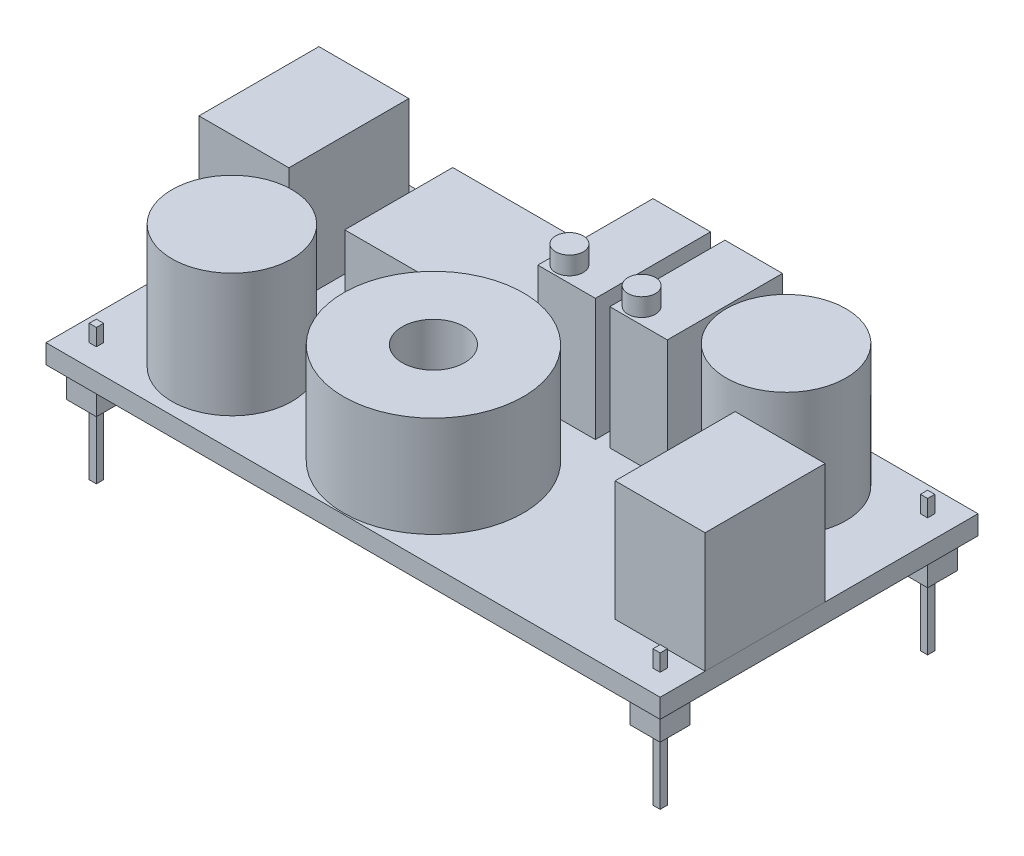
from build123d import *

# Parameters (mm, degrees)
ESQUISSE1_W               = 51.2
ESQUISSE1_H               = 26.5
BOSS_EXTRU_1_DEPTH        = 1.6
ESQUISSE2_W               = 7.5
ESQUISSE2_H               = 10
BOSS_EXTRU_2_DEPTH        = 10
BOSS_EXTRU_2_2_DEPTH      = 10
ESQUISSE3_R               = 5
BOSS_EXTRU_3_DEPTH        = 10.3
BOSS_EXTRU_3_2_DEPTH      = 10.3
ESQUISSE4_W               = 4.8
ESQUISSE4_H               = 9.6
BOSS_EXTRU_4_DEPTH        = 10.2
BOSS_EXTRU_4_2_DEPTH      = 10.2
ESQUISSE5_R               = 1.15
BOSS_EXTRU_5_DEPTH        = 1.5
BOSS_EXTRU_5_2_DEPTH      = 1.5
ESQUISSE6_R               = 7.5
ESQUISSE6_R_2             = 2.6
BOSS_EXTRU_6_DEPTH        = 8.4
ESQUISSE7_W               = 14
ESQUISSE7_H               = 9
BOSS_EXTRU_7_DEPTH        = 4.7
BOSS_EXTRU_8_DEPTH        = 8.3
BOSS_EXTRU_8_DEPTH_BACK   = 3
ESQUISSE8_W               = 0.6
ESQUISSE8_H               = 0.6
BOSS_EXTRU_8_2_DEPTH      = 8.3
BOSS_EXTRU_8_2_DEPTH_BACK = 3
BOSS_EXTRU_8_3_DEPTH      = 8.3
BOSS_EXTRU_8_3_DEPTH_BACK = 3
BOSS_EXTRU_8_4_DEPTH      = 8.3
BOSS_EXTRU_8_4_DEPTH_BACK = 3
ESQUISSE9_W               = 2.5
ESQUISSE9_H               = 2.5
BOSS_EXTRU_9_DEPTH        = 2.5
BOSS_EXTRU_9_2_DEPTH      = 2.5
BOSS_EXTRU_9_3_DEPTH      = 2.5
BOSS_EXTRU_9_4_DEPTH      = 2.5


with BuildPart() as part:
    # Esquisse1 → Boss.-Extru.1 (new body)
    with BuildSketch(Plane(origin=(0, 0, 0), x_dir=(1, 0, 0), z_dir=(0, 1, 0))):
        Rectangle(ESQUISSE1_W, ESQUISSE1_H)
    extrude(amount=BOSS_EXTRU_1_DEPTH)


with BuildPart() as body_2:
    # Esquisse2 → Boss.-Extru.2 (new body)
    with BuildSketch(Plane(origin=(0, 1.6, 0), x_dir=(1, 0, 0), z_dir=(0, 1, 0))):
        with Locations((-21.85, 4.5)):
            Rectangle(ESQUISSE2_W, ESQUISSE2_H)
    extrude(amount=BOSS_EXTRU_2_DEPTH)


with BuildPart() as body_3:
    # Esquisse2 → Boss.-Extru.2 2 (new body)
    with BuildSketch(Plane(origin=(0, 1.6, 0), x_dir=(1, 0, 0), z_dir=(0, 1, 0))):
        with Locations((21.85, -4.5)):
            Rectangle(ESQUISSE2_W, ESQUISSE2_H)
    extrude(amount=BOSS_EXTRU_2_2_DEPTH)


with BuildPart() as body_4:
    # Esquisse3 → Boss.-Extru.3 (new body)
    with BuildSketch(Plane(origin=(0, 1.6, 0), x_dir=(1, 0, 0), z_dir=(0, 1, 0))):
        with Locations(Location((15.6, 7.25, 0), (0, 0, 90))):
            Circle(ESQUISSE3_R)
    extrude(amount=BOSS_EXTRU_3_DEPTH)


with BuildPart() as body_5:
    # Esquisse3 → Boss.-Extru.3 2 (new body)
    with BuildSketch(Plane(origin=(0, 1.6, 0), x_dir=(1, 0, 0), z_dir=(0, 1, 0))):
        with Locations(Location((-16.1, -7.25, 0), (0, 0, 90))):
            Circle(ESQUISSE3_R)
    extrude(amount=BOSS_EXTRU_3_2_DEPTH)


with BuildPart() as body_6:
    # Esquisse4 → Boss.-Extru.4 (new body)
    with BuildSketch(Plane(origin=(0, 1.6, 0), x_dir=(1, 0, 0), z_dir=(0, 1, 0))):
        with Locations((1.9, 7.45)):
            Rectangle(ESQUISSE4_W, ESQUISSE4_H)
    extrude(amount=BOSS_EXTRU_4_DEPTH)


with BuildPart() as body_7:
    # Esquisse4 → Boss.-Extru.4 2 (new body)
    with BuildSketch(Plane(origin=(0, 1.6, 0), x_dir=(1, 0, 0), z_dir=(0, 1, 0))):
        with Locations((7.9, 7.45)):
            Rectangle(ESQUISSE4_W, ESQUISSE4_H)
    extrude(amount=BOSS_EXTRU_4_2_DEPTH)


with BuildPart() as body_8:
    # Esquisse5 → Boss.-Extru.5 (new body)
    with BuildSketch(Plane(origin=(0, 11.8, 0), x_dir=(1, 0, 0), z_dir=(0, 1, 0))):
        with Locations(Location((0.784252414, 4.00485602, 0), (0, 0, 270))):
            Circle(ESQUISSE5_R)
    extrude(amount=BOSS_EXTRU_5_DEPTH)


with BuildPart() as body_9:
    # Esquisse5 → Boss.-Extru.5 2 (new body)
    with BuildSketch(Plane(origin=(0, 11.8, 0), x_dir=(1, 0, 0), z_dir=(0, 1, 0))):
        with Locations(Location((6.804540863, 4.00485602, 0), (0, 0, 270))):
            Circle(ESQUISSE5_R)
    extrude(amount=BOSS_EXTRU_5_2_DEPTH)


with BuildPart() as body_10:
    # Esquisse6 → Boss.-Extru.6 (new body)
    with BuildSketch(Plane(origin=(0, 1.6, 0), x_dir=(1, 0, 0), z_dir=(0, 1, 0))):
        with Locations(Location((-0.9, -5.65, 0), (0, 0, 270))):
            Circle(ESQUISSE6_R)
        with Locations(Location((-0.9, -5.65, 0), (0, 0, 270))):
            Circle(ESQUISSE6_R_2, mode=Mode.SUBTRACT)
    extrude(amount=BOSS_EXTRU_6_DEPTH)


with BuildPart() as body_11:
    # Esquisse7 → Boss.-Extru.7 (new body)
    with BuildSketch(Plane(origin=(0, 1.6, 0), x_dir=(1, 0, 0), z_dir=(0, 1, 0))):
        with Locations((-9.592278393, 7.15)):
            Rectangle(ESQUISSE7_W, ESQUISSE7_H)
    extrude(amount=BOSS_EXTRU_7_DEPTH)


with BuildPart() as body_12:
    # Esquisse8 → Boss.-Extru.8 (new, two sides: drawn at the far end of the back side and taken through both)
    with BuildSketch(Plane.XZ.offset(-BOSS_EXTRU_8_DEPTH_BACK)):
        with Locations((-23.5, 11.15)):
            Rectangle(ESQUISSE8_W, ESQUISSE8_H)
    extrude(amount=BOSS_EXTRU_8_DEPTH + BOSS_EXTRU_8_DEPTH_BACK)


with BuildPart() as body_13:
    # Esquisse8 → Boss.-Extru.8 2 (new, two sides: drawn at the far end of the back side and taken through both)
    with BuildSketch(Plane.XZ.offset(-BOSS_EXTRU_8_2_DEPTH_BACK)):
        with Locations((23.5, 11.15)):
            Rectangle(ESQUISSE8_W, ESQUISSE8_H)
    extrude(amount=BOSS_EXTRU_8_2_DEPTH + BOSS_EXTRU_8_2_DEPTH_BACK)


with BuildPart() as body_14:
    # Esquisse8 → Boss.-Extru.8 3 (new, two sides: drawn at the far end of the back side and taken through both)
    with BuildSketch(Plane.XZ.offset(-BOSS_EXTRU_8_3_DEPTH_BACK)):
        with Locations((23.5, -11.15)):
            Rectangle(ESQUISSE8_W, ESQUISSE8_H)
    extrude(amount=BOSS_EXTRU_8_3_DEPTH + BOSS_EXTRU_8_3_DEPTH_BACK)


with BuildPart() as body_15:
    # Esquisse8 → Boss.-Extru.8 4 (new, two sides: drawn at the far end of the back side and taken through both)
    with BuildSketch(Plane.XZ.offset(-BOSS_EXTRU_8_4_DEPTH_BACK)):
        with Locations((-23.5, -11.15)):
            Rectangle(ESQUISSE8_W, ESQUISSE8_H)
    extrude(amount=BOSS_EXTRU_8_4_DEPTH + BOSS_EXTRU_8_4_DEPTH_BACK)


with BuildPart() as body_16:
    # Esquisse9 → Boss.-Extru.9 (new body)
    with BuildSketch(Plane.XZ):
        with Locations((-23.5, 11.15)):
            Rectangle(ESQUISSE9_W, ESQUISSE9_H)
    extrude(amount=BOSS_EXTRU_9_DEPTH)


with BuildPart() as body_17:
    # Esquisse9 → Boss.-Extru.9 2 (new body)
    with BuildSketch(Plane.XZ):
        with Locations((23.5, 11.15)):
            Rectangle(ESQUISSE9_W, ESQUISSE9_H)
    extrude(amount=BOSS_EXTRU_9_2_DEPTH)


with BuildPart() as body_18:
    # Esquisse9 → Boss.-Extru.9 3 (new body)
    with BuildSketch(Plane.XZ):
        with Locations((23.5, -11.15)):
            Rectangle(ESQUISSE9_W, ESQUISSE9_H)
    extrude(amount=BOSS_EXTRU_9_3_DEPTH)


with BuildPart() as body_19:
    # Esquisse9 → Boss.-Extru.9 4 (new body)
    with BuildSketch(Plane.XZ):
        with Locations((-23.5, -11.15)):
            Rectangle(ESQUISSE9_W, ESQUISSE9_H)
    extrude(amount=BOSS_EXTRU_9_4_DEPTH)


solid = Compound([part.part, body_2.part, body_3.part, body_4.part, body_5.part, body_6.part, body_7.part, body_8.part, body_9.part, body_10.part, body_11.part, body_12.part, body_13.part, body_14.part, body_15.part, body_16.part, body_17.part, body_18.part, body_19.part])
